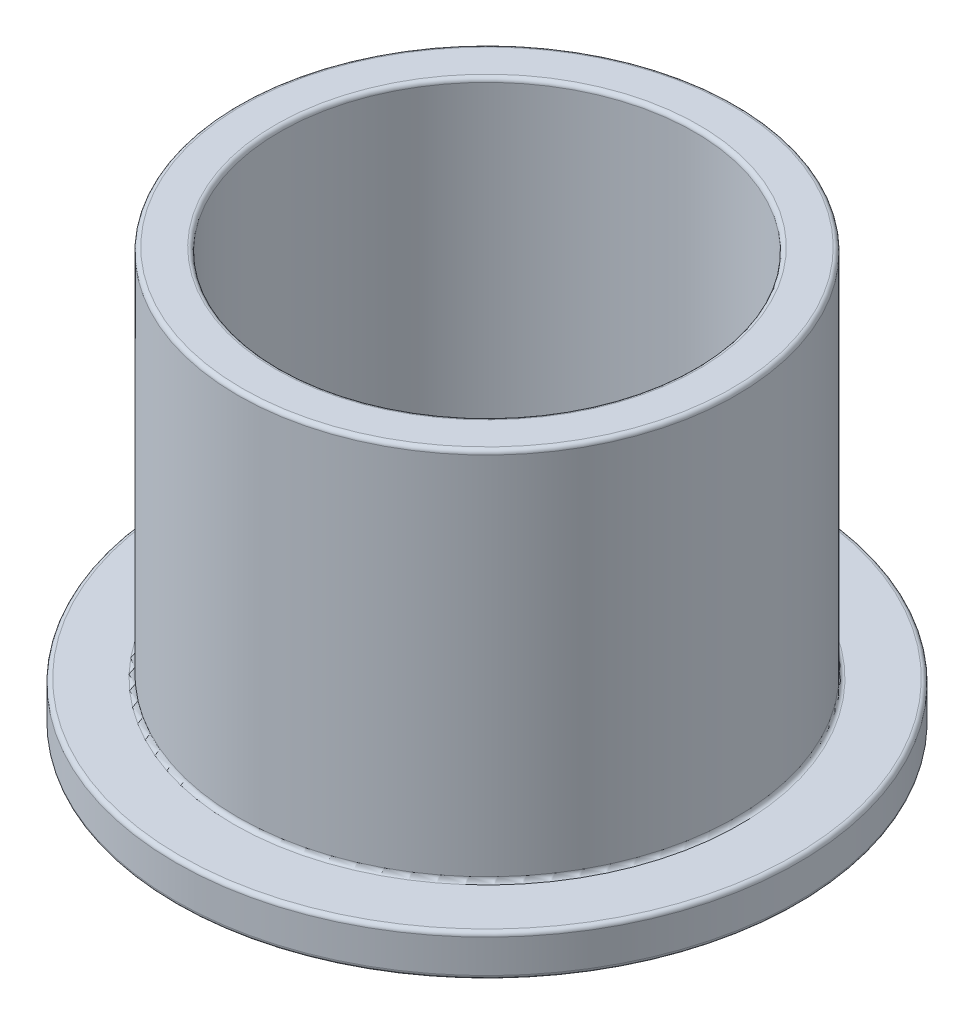
from build123d import *

# Parameters (mm, degrees)
SKETCH3_R           = 4.8
SKETCH3_R_2         = 4
BOSS_EXTRUDE1_DEPTH = 8
SKETCH4_R           = 6
SKETCH4_R_2         = 4.8
BOSS_EXTRUDE2_DEPTH = 0.8
FILLET1_R           = 0.08


with BuildPart() as part:
    # Sketch3 → Boss-Extrude1 (new body)
    with BuildSketch(Plane(origin=(0, 0, 0), x_dir=(1, 0, 0), z_dir=(0, 1, 0))):
        with Locations(Location((0, 0, 0), (0, 0, 270))):
            Circle(SKETCH3_R)
        with Locations(Location((0, 0, 0), (0, 0, 270))):
            Circle(SKETCH3_R_2, mode=Mode.SUBTRACT)
    extrude(amount=BOSS_EXTRUDE1_DEPTH)

    # Sketch4 → Boss-Extrude2 (add)
    with BuildSketch(Plane(origin=(0, 0, 0), x_dir=(1, 0, 0), z_dir=(0, 1, 0))):
        with Locations(Location((0, 0, 0), (0, 0, 270))):
            Circle(SKETCH4_R)
        with Locations(Location((0, 0, 0), (0, 0, 270))):
            Circle(SKETCH4_R_2, mode=Mode.SUBTRACT)
    extrude(amount=BOSS_EXTRUDE2_DEPTH)

    # Fillet1
    fillet1_edges = [part.edges().sort_by_distance(p)[0] for p in [
        (0, 0, -6),
        (0, 0.8, -4.8),
        (0, 8, -4.8),
        (0, 0, -4),
        (0, 8, -4),
        (0, 0.8, -6),
    ]]
    fillet(fillet1_edges, radius=FILLET1_R)


solid = part.part
